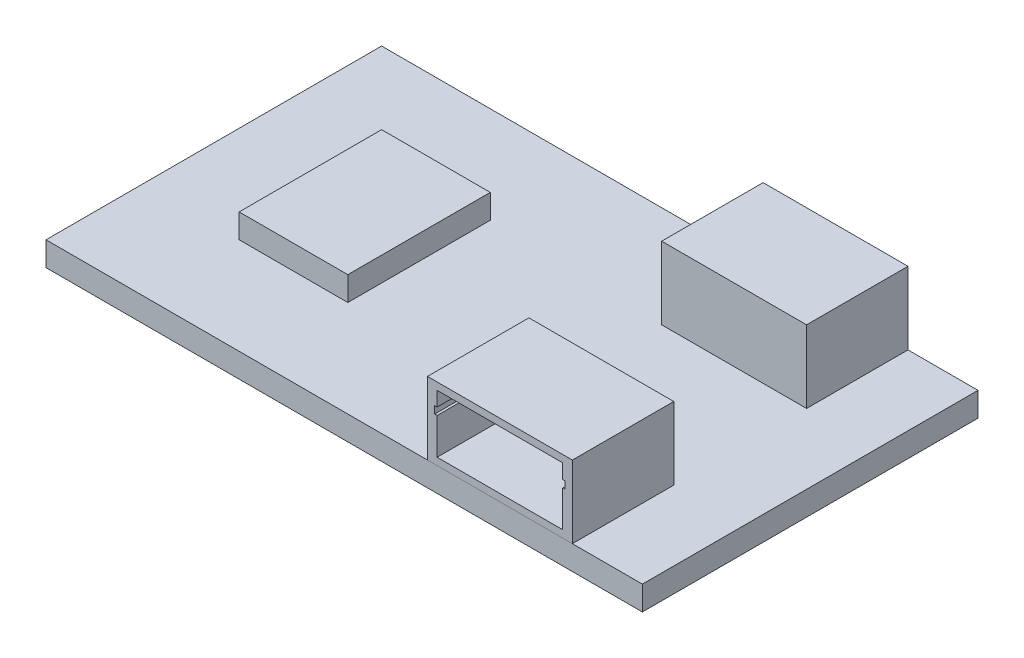
from build123d import *

# Parameters (mm, degrees)
SKETCH1_W             = 24.7
SKETCH1_H             = 13.9
BOSS_EXTRUDE1_DEPTH   = 1
SKETCH2_W             = 6
SKETCH2_H             = 4.2
BOSS_EXTRUDE2_DEPTH   = 3
BOSS_EXTRUDE2_2_DEPTH = 3
CUT_EXTRUDE1_DEPTH    = 3
CUT_EXTRUDE2_DEPTH    = 3
SKETCH6_W             = 4.5
SKETCH6_H             = 5.9
BOSS_EXTRUDE3_DEPTH   = 1


with BuildPart() as part:
    # Sketch1 → Boss-Extrude1 (new body)
    with BuildSketch(Plane(origin=(0, 0, 0), x_dir=(1, 0, 0), z_dir=(0, 1, 0))):
        Rectangle(SKETCH1_W, SKETCH1_H)
    extrude(amount=BOSS_EXTRUDE1_DEPTH)

    # Sketch6 → Boss-Extrude3 (add)
    with BuildSketch(Plane(origin=(0, 1, 0), x_dir=(1, 0, 0), z_dir=(0, 1, 0))):
        with Locations((-6.1, 0)):
            Rectangle(SKETCH6_W, SKETCH6_H)
    extrude(amount=BOSS_EXTRUDE3_DEPTH)


with BuildPart() as body_2:
    # Sketch2 → Boss-Extrude2 (new body)
    with BuildSketch(Plane(origin=(0, 1, 0), x_dir=(1, 0, 0), z_dir=(0, 1, 0))):
        with Locations((6.45, -4.85)):
            Rectangle(SKETCH2_W, SKETCH2_H)
    extrude(amount=BOSS_EXTRUDE2_DEPTH)

    # Sketch3 → Cut-Extrude1 (cut)
    with BuildSketch(Plane.XY.offset(6.95)):
        Polygon((3.85, 3.7), (3.85, 3.1), (3.75, 3.1), (3.75, 2.8), (3.85, 2.8), (3.85, 1.3), (9.05, 1.3), (9.05, 2.8), (9.15, 2.8), (9.15, 3.1), (9.05, 3.1), (9.05, 3.7), align=None)
    extrude(amount=-CUT_EXTRUDE1_DEPTH, mode=Mode.SUBTRACT)


with BuildPart() as body_3:
    # Sketch2 → Boss-Extrude2 2 (new body)
    with BuildSketch(Plane(origin=(0, 1, 0), x_dir=(1, 0, 0), z_dir=(0, 1, 0))):
        with Locations((6.45, 4.85)):
            Rectangle(SKETCH2_W, SKETCH2_H)
    extrude(amount=BOSS_EXTRUDE2_2_DEPTH)

    # Sketch5 → Cut-Extrude2 (cut)
    with BuildSketch(Plane(origin=(0, 0, -6.95), x_dir=(-1, 0, 0), z_dir=(0, 0, -1))):
        Polygon((-9.15, 3.7), (-9.15, 3.1), (-9.25, 3.1), (-9.25, 2.8), (-9.15, 2.8), (-9.15, 1.3), (-3.75, 1.3), (-3.75, 2.8), (-3.65, 2.8), (-3.65, 3.1), (-3.75, 3.1), (-3.75, 3.7), align=None)
    extrude(amount=-CUT_EXTRUDE2_DEPTH, mode=Mode.SUBTRACT)


solid = Compound([part.part, body_2.part, body_3.part])
